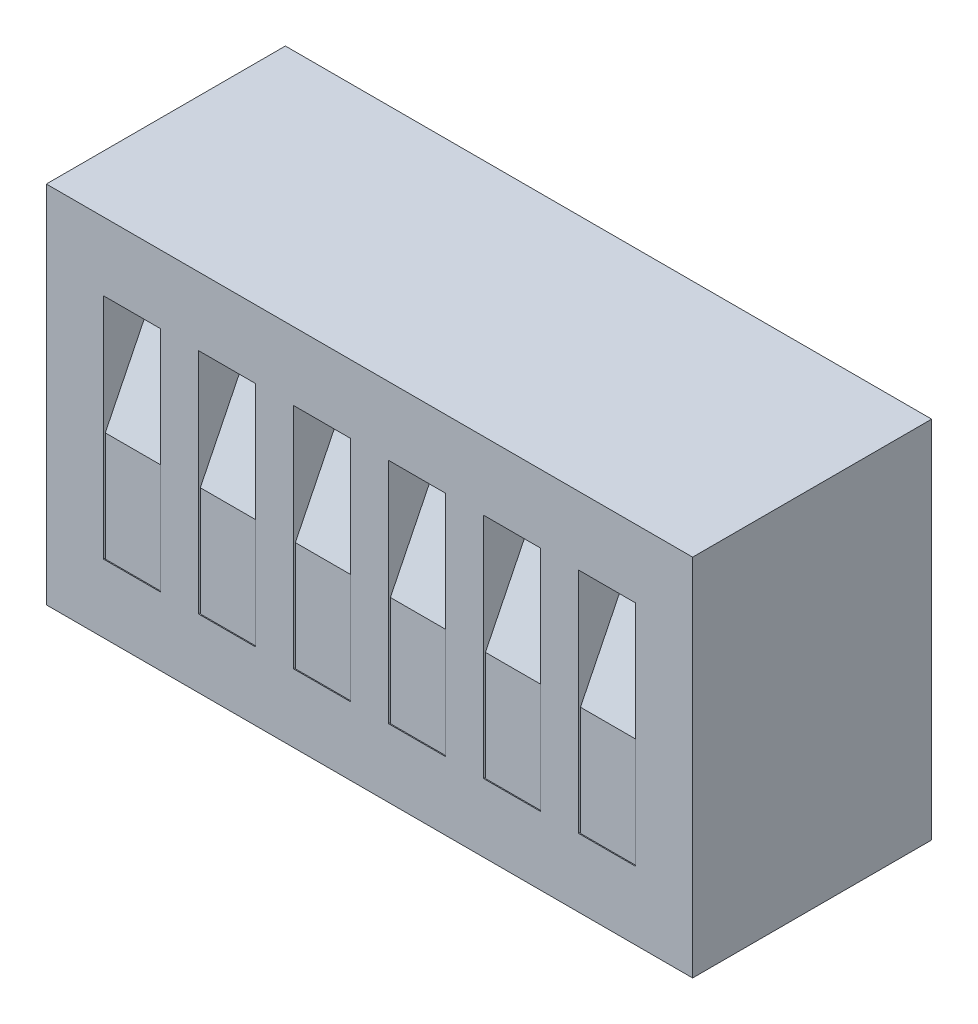
from build123d import *

# Parameters (mm, degrees)
SKETCH1_W           = 17.272
SKETCH1_H           = 9.7409
BOSS_EXTRUDE1_DEPTH = 6.3881
SKETCH2_W           = 1.524
SKETCH2_H           = 6.096
CUT_EXTRUDE1_DEPTH  = 2.54
LPATTERN1_COUNT     = 6
LPATTERN1_PITCH     = 2.54
BOSS_EXTRUDE2_DEPTH = 1.4732
LPATTERN2_COUNT     = 6
LPATTERN2_PITCH     = 2.54


with BuildPart() as part:
    # Sketch1 → Boss-Extrude1 (new body)
    with BuildSketch(Plane.XY.offset(6.3881)):
        with Locations((8.636, 4.87045)):
            Rectangle(SKETCH1_W, SKETCH1_H)
    extrude(amount=-BOSS_EXTRUDE1_DEPTH)

    # Sketch2 → Cut-Extrude1 (cut)
    with BuildSketch(Plane.XY.offset(6.3881)):
        with Locations((2.286, 4.87045)):
            Rectangle(SKETCH2_W, SKETCH2_H)
    cut_extrude1 = extrude(amount=-CUT_EXTRUDE1_DEPTH, mode=Mode.SUBTRACT)

    # LPattern1: Cut-Extrude1 ×6
    with Locations(*[(i * LPATTERN1_PITCH, 0, 0) for i in range(1, LPATTERN1_COUNT)]):
        add(cut_extrude1, mode=Mode.SUBTRACT)

    # Sketch3 → Boss-Extrude2 (add)
    with BuildSketch(Plane(origin=(3.0226, 0, 0), x_dir=(0, 0, -1), z_dir=(1, 0, 0))):
        Polygon((-6.3627, 1.82245), (-3.8481, 1.82245), (-3.8481, 7.91845), (-4.8006, 7.91845), (-6.3627, 4.74345), align=None)
    boss_extrude2 = extrude(amount=-BOSS_EXTRUDE2_DEPTH)

    # LPattern2: Boss-Extrude2 ×6
    with Locations(*[(i * LPATTERN2_PITCH, 0, 0) for i in range(1, LPATTERN2_COUNT)]):
        add(boss_extrude2)


solid = part.part
